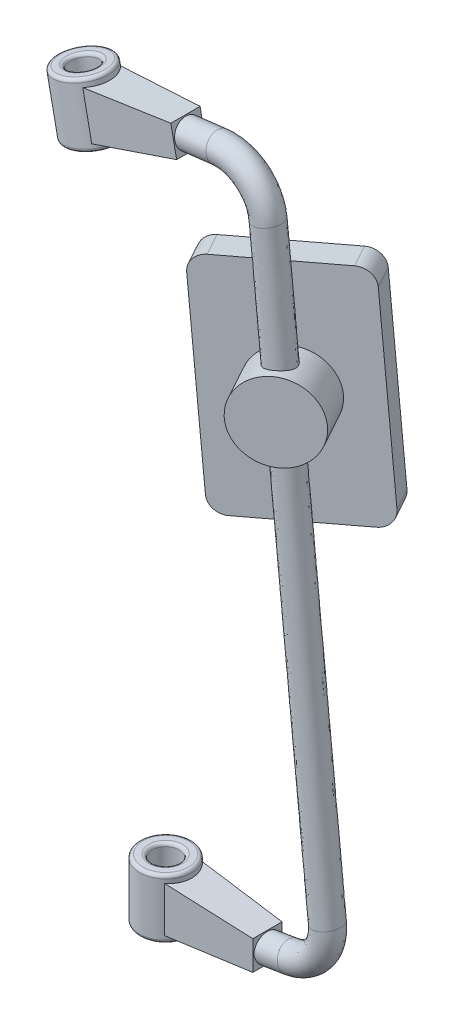
from build123d import *

# Parameters (mm, degrees)
SKETCH1_R           = 24
SKETCH1_R_2         = 12.5
BOSS_EXTRUDE1_DEPTH = 27.5
FILLET1_R           = 3
SKETCH8_R           = 24
SKETCH8_R_2         = 12.5
BOSS_EXTRUDE2_DEPTH = 55
FILLET2_R           = 3
SKETCH17_R          = 12.5
SKETCH20_R          = 35
BOSS_EXTRUDE5_DEPTH = 20
BOSS_EXTRUDE6_DEPTH = 25


with BuildPart() as part:
    # Sketch1 → Boss-Extrude1 (new, symmetric)
    with BuildSketch(Plane(origin=(0, 0, 0), x_dir=(1, 0, 0), z_dir=(0, 1, 0))):
        with Locations(Location((0, 0, 0), (0, 0, 270))):
            Circle(SKETCH1_R)
        with Locations(Location((0, 0, 0), (0, 0, 270))):
            Circle(SKETCH1_R_2, mode=Mode.SUBTRACT)
    extrude(amount=BOSS_EXTRUDE1_DEPTH, both=True)

    # Fillet1
    fillet1_edges = [part.edges().sort_by_distance(p)[0] for p in [
        (0, -27.5, -24),
        (0, 27.5, -24),
        (0, -27.5, -12.5),
        (0, 27.5, -12.5),
    ]]
    fillet(fillet1_edges, radius=FILLET1_R)

    # Sketch4 → Loft1 section 0
    with BuildSketch(Plane(origin=(15, 0, 0), x_dir=(0, 0, -1), z_dir=(1, 0, 0))):
        with BuildLine():
            Line((-17.5, 21), (17.5, 21))
            Line((17.5, 21), (17.5, -21))
            Line((17.5, -21), (-17.5, -21))
            Line((-17.5, -21), (-17.5, 21))
        make_face()
    # Sketch11 → Loft1 section 1
    with BuildSketch(Plane(origin=(94, 0, 0), x_dir=(0, 0, -1), z_dir=(1, 0, 0))):
        with BuildLine():
            Line((-13.5, 13.5), (13.5, 13.5))
            Line((13.5, 13.5), (13.5, -13.5))
            Line((13.5, -13.5), (-13.5, -13.5))
            Line((-13.5, -13.5), (-13.5, 13.5))
        make_face()
    loft()



with BuildPart() as body_2:
    # Sketch8 → Boss-Extrude2 (new body)
    with BuildSketch(Plane(origin=(-65.680411397, 569.084793841, 0), x_dir=(0.979986183571971, 0.19906551687332288, 0), z_dir=(-0.19906551687332288, 0.979986183571971, 0))):
        with Locations(Location((0, 0, 0), (0, 0, 180))):
            Circle(SKETCH8_R)
        with Locations(Location((0, 0, 0), (0, 0, 180))):
            Circle(SKETCH8_R_2, mode=Mode.SUBTRACT)
    extrude(amount=BOSS_EXTRUDE2_DEPTH)

    # Fillet2
    fillet2_edges = [body_2.edges().sort_by_distance(p)[0] for p in [
        (-42.160742991, 573.862366246, 0),
        (-53.109346419, 627.761606342, 0),
        (-53.430584102, 571.573112802, 0),
        (-64.37918753, 625.472352898, 0),
    ]]
    fillet(fillet2_edges, radius=FILLET2_R)

    # Sketch14 → Loft2 section 0
    with BuildSketch(Plane(origin=(62.639994536, 12.724121113, 0), x_dir=(0, 0, -1), z_dir=(0.9799861835719711, 0.19906551687332286, 0))):
        with BuildLine():
            Line((-17.5, 619.269940288), (17.5, 619.269940288))
            Line((17.5, 619.269940288), (17.5, 577.269940288))
            Line((17.5, 577.269940288), (-17.5, 577.269940288))
            Line((-17.5, 577.269940288), (-17.5, 619.269940288))
        make_face()
    # Sketch15 → Loft2 section 1
    with BuildSketch(Plane(origin=(20.963988145, 614.746572475, 0), x_dir=(0, 0, -1), z_dir=(0.979986183571971, 0.19906551687332316, 0))):
        with BuildLine():
            Line((-13.5, 13.5), (13.5, 13.5))
            Line((13.5, 13.5), (13.5, -13.5))
            Line((13.5, -13.5), (-13.5, -13.5))
            Line((-13.5, -13.5), (-13.5, 13.5))
        make_face()
    loft()


with BuildPart() as part_1:
    add(part.part)

    add(body_2.part)  # Sweep2 merges body 2
    # Sweep2: sweep along a path in Sketch16
    with BuildLine(Plane.XY) as sweep2_path:
        Line((20.963988145, 614.746572475), (50.030747064, 618.247376756))
        ThreePointArc((50.030747064, 618.247376756), (79.79387171, 609.775298646), (94.606107718, 582.605142948))
        Line((94.606107718, 582.605142948), (149.384919441, 47.134704187))
        ThreePointArc((149.384919441, 47.134704187), (141.344737808, 18.736962845), (116.017972197, 3.583376546))
        Line((116.017972197, 3.583376546), (94, 0))
    # Sketch17 → Sweep2 (sweep)
    with BuildSketch(Plane(origin=(140.058903038, 28.450296946, 0), x_dir=(0, 0, -1), z_dir=(0.9799861835719709, 0.1990655168733233, 0))):
        with Locations((0, 598.269940288)):
            Circle(SKETCH17_R)
    sweep(path=sweep2_path.line)

    # Sketch20 → Boss-Extrude5 (add, symmetric)
    with BuildSketch(Plane(origin=(38.152425107, 3.903006329, 66.426824401), x_dir=(0.10176920733394475, -0.9948080359740872, 0), z_dir=(0.49740401798703254, 0.05088460366697124, 0.866025403784445))):
        with Locations(Location((-426.663962146, 132.853648801, 0), (0, 0, 84.937116254))):
            Circle(SKETCH20_R)
    extrude(amount=BOSS_EXTRUDE5_DEPTH, both=True)

    # Sketch19 → Boss-Extrude6 (add)
    with BuildSketch(Plane(origin=(15.769244298, 1.613199164, 27.45568123), x_dir=(0.10176920733394475, -0.9948080359740872, 0), z_dir=(0.49740401798703254, 0.05088460366697124, 0.866025403784445))):
        with BuildLine():
            Line((-511.663962146, 197.853648801), (-341.663962146, 197.853648801))
            ThreePointArc((-341.663962146, 197.853648801), (-331.057360428, 193.460250519), (-326.663962146, 182.853648801))
            Line((-326.663962146, 182.853648801), (-326.663962146, 82.853648801))
            ThreePointArc((-326.663962146, 82.853648801), (-331.057360428, 72.247047083), (-341.663962146, 67.853648801))
            Line((-341.663962146, 67.853648801), (-511.663962146, 67.853648801))
            ThreePointArc((-511.663962146, 67.853648801), (-522.270563864, 72.247047083), (-526.663962146, 82.853648801))
            Line((-526.663962146, 82.853648801), (-526.663962146, 182.853648801))
            ThreePointArc((-526.663962146, 182.853648801), (-522.270563864, 193.460250519), (-511.663962146, 197.853648801))
        make_face()
    extrude(amount=BOSS_EXTRUDE6_DEPTH)


solid = part_1.part
